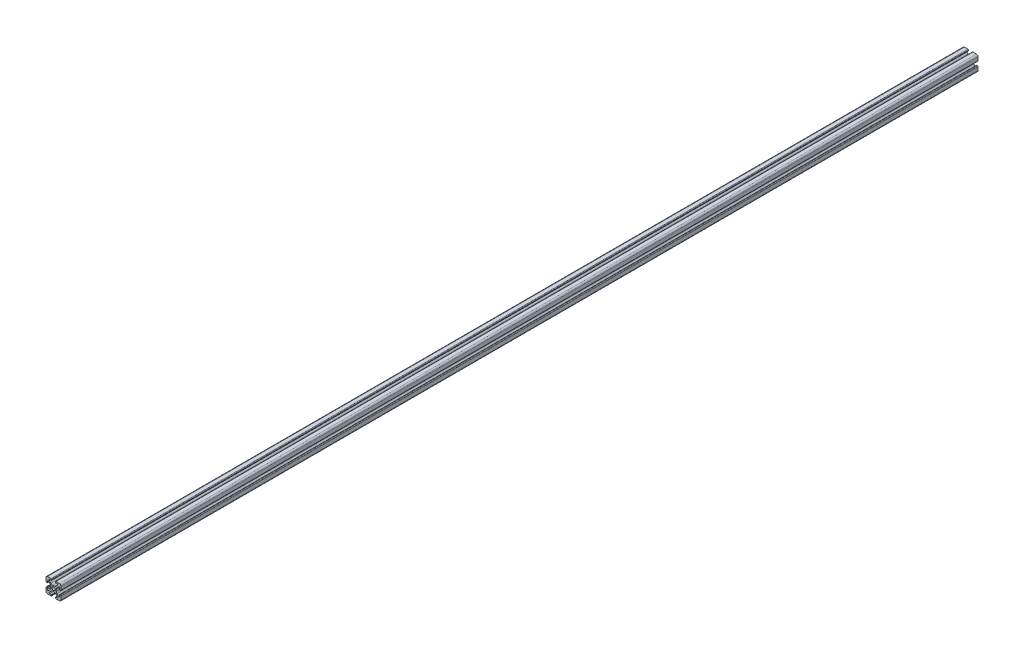
from build123d import *

# Parameters (mm, degrees)
SKETCH1_R           = 2.1463
BOSS_EXTRUDE1_DEPTH = 609.6


with BuildPart() as part:
    # Sketch1 → Boss-Extrude1 (new, symmetric)
    with BuildSketch(Plane.XY):
        with BuildLine():
            Line((-9.9949, 7.9883), (-9.9949, 3.2893))
            ThreePointArc((-9.9949, 3.2893), (-9.76427588, 2.73252412), (-9.2075, 2.5019))
            Line((-9.2075, 2.5019), (-8.4963, 2.5019))
            ThreePointArc((-8.4963, 2.5019), (-8.280773853, 2.591173853), (-8.1915, 2.8067))
            Line((-8.1915, 2.8067), (-8.1915, 4.9149))
            ThreePointArc((-8.1915, 4.9149), (-7.674065253, 5.689295824), (-6.760603096, 5.507596904))
            Line((-6.760603096, 5.507596904), (-4.505765747, 3.252759555))
            ThreePointArc((-4.505765747, 3.252759555), (-3.856054457, 2.280397894), (-3.627906192, 1.133419111))
            Line((-3.627906192, 1.133419111), (-3.627906192, -1.133419111))
            ThreePointArc((-3.627906192, -1.133419111), (-3.856054457, -2.280397894), (-4.505765747, -3.252759555))
            Line((-4.505765747, -3.252759555), (-6.760603096, -5.507596904))
            ThreePointArc((-6.760603096, -5.507596904), (-7.674065253, -5.689295824), (-8.1915, -4.9149))
            Line((-8.1915, -4.9149), (-8.1915, -2.8067))
            ThreePointArc((-8.1915, -2.8067), (-8.280773853, -2.591173853), (-8.4963, -2.5019))
            Line((-8.4963, -2.5019), (-9.2075, -2.5019))
            ThreePointArc((-9.2075, -2.5019), (-9.76427588, -2.73252412), (-9.9949, -3.2893))
            Line((-9.9949, -3.2893), (-9.9949, -7.9883))
            ThreePointArc((-9.9949, -7.9883), (-9.407180467, -9.407180467), (-7.9883, -9.9949))
            Line((-7.9883, -9.9949), (-3.2893, -9.9949))
            ThreePointArc((-3.2893, -9.9949), (-2.73252412, -9.76427588), (-2.5019, -9.2075))
            Line((-2.5019, -9.2075), (-2.5019, -8.4963))
            ThreePointArc((-2.5019, -8.4963), (-2.591173853, -8.280773853), (-2.8067, -8.1915))
            Line((-2.8067, -8.1915), (-4.9149, -8.1915))
            ThreePointArc((-4.9149, -8.1915), (-5.689295824, -7.674065253), (-5.507596904, -6.760603096))
            Line((-5.507596904, -6.760603096), (-3.252759555, -4.505765747))
            ThreePointArc((-3.252759555, -4.505765747), (-2.280397894, -3.856054457), (-1.133419111, -3.627906192))
            Line((-1.133419111, -3.627906192), (1.133419111, -3.627906192))
            ThreePointArc((1.133419111, -3.627906192), (2.280397894, -3.856054457), (3.252759555, -4.505765747))
            Line((3.252759555, -4.505765747), (5.507596904, -6.760603096))
            ThreePointArc((5.507596904, -6.760603096), (5.689295824, -7.674065253), (4.9149, -8.1915))
            Line((4.9149, -8.1915), (2.8067, -8.1915))
            ThreePointArc((2.8067, -8.1915), (2.591173853, -8.280773853), (2.5019, -8.4963))
            Line((2.5019, -8.4963), (2.5019, -9.2075))
            ThreePointArc((2.5019, -9.2075), (2.73252412, -9.76427588), (3.2893, -9.9949))
            Line((3.2893, -9.9949), (7.9883, -9.9949))
            ThreePointArc((7.9883, -9.9949), (9.407180467, -9.407180467), (9.9949, -7.9883))
            Line((9.9949, -7.9883), (9.9949, -3.2893))
            ThreePointArc((9.9949, -3.2893), (9.76427588, -2.73252412), (9.2075, -2.5019))
            Line((9.2075, -2.5019), (8.4963, -2.5019))
            ThreePointArc((8.4963, -2.5019), (8.280773853, -2.591173853), (8.1915, -2.8067))
            Line((8.1915, -2.8067), (8.1915, -4.9149))
            ThreePointArc((8.1915, -4.9149), (7.674065253, -5.689295824), (6.760603096, -5.507596904))
            Line((6.760603096, -5.507596904), (4.505765747, -3.252759555))
            ThreePointArc((4.505765747, -3.252759555), (3.856054457, -2.280397894), (3.627906192, -1.133419111))
            Line((3.627906192, -1.133419111), (3.627906192, 1.133419111))
            ThreePointArc((3.627906192, 1.133419111), (3.856054457, 2.280397894), (4.505765747, 3.252759555))
            Line((4.505765747, 3.252759555), (6.760603096, 5.507596904))
            ThreePointArc((6.760603096, 5.507596904), (7.674065253, 5.689295824), (8.1915, 4.9149))
            Line((8.1915, 4.9149), (8.1915, 2.8067))
            ThreePointArc((8.1915, 2.8067), (8.280773853, 2.591173853), (8.4963, 2.5019))
            Line((8.4963, 2.5019), (9.2075, 2.5019))
            ThreePointArc((9.2075, 2.5019), (9.76427588, 2.73252412), (9.9949, 3.2893))
            Line((9.9949, 3.2893), (9.9949, 7.9883))
            ThreePointArc((9.9949, 7.9883), (9.407180467, 9.407180467), (7.9883, 9.9949))
            Line((7.9883, 9.9949), (3.2893, 9.9949))
            ThreePointArc((3.2893, 9.9949), (2.73252412, 9.76427588), (2.5019, 9.2075))
            Line((2.5019, 9.2075), (2.5019, 8.4963))
            ThreePointArc((2.5019, 8.4963), (2.591173853, 8.280773853), (2.8067, 8.1915))
            Line((2.8067, 8.1915), (4.9149, 8.1915))
            ThreePointArc((4.9149, 8.1915), (5.689295824, 7.674065253), (5.507596904, 6.760603096))
            Line((5.507596904, 6.760603096), (3.252759555, 4.505765747))
            ThreePointArc((3.252759555, 4.505765747), (2.280397894, 3.856054457), (1.133419111, 3.627906192))
            Line((1.133419111, 3.627906192), (-1.133419111, 3.627906192))
            ThreePointArc((-1.133419111, 3.627906192), (-2.280397894, 3.856054457), (-3.252759555, 4.505765747))
            Line((-3.252759555, 4.505765747), (-5.507596904, 6.760603096))
            ThreePointArc((-5.507596904, 6.760603096), (-5.689295824, 7.674065253), (-4.9149, 8.1915))
            Line((-4.9149, 8.1915), (-2.8067, 8.1915))
            ThreePointArc((-2.8067, 8.1915), (-2.591173853, 8.280773853), (-2.5019, 8.4963))
            Line((-2.5019, 8.4963), (-2.5019, 9.2075))
            ThreePointArc((-2.5019, 9.2075), (-2.73252412, 9.76427588), (-3.2893, 9.9949))
            Line((-3.2893, 9.9949), (-7.9883, 9.9949))
            ThreePointArc((-7.9883, 9.9949), (-9.407180467, 9.407180467), (-9.9949, 7.9883))
        make_face()
        with Locations(Location((0, 0, 0), (0, 0, 180))):
            Circle(SKETCH1_R, mode=Mode.SUBTRACT)
    extrude(amount=BOSS_EXTRUDE1_DEPTH, both=True)


solid = part.part
